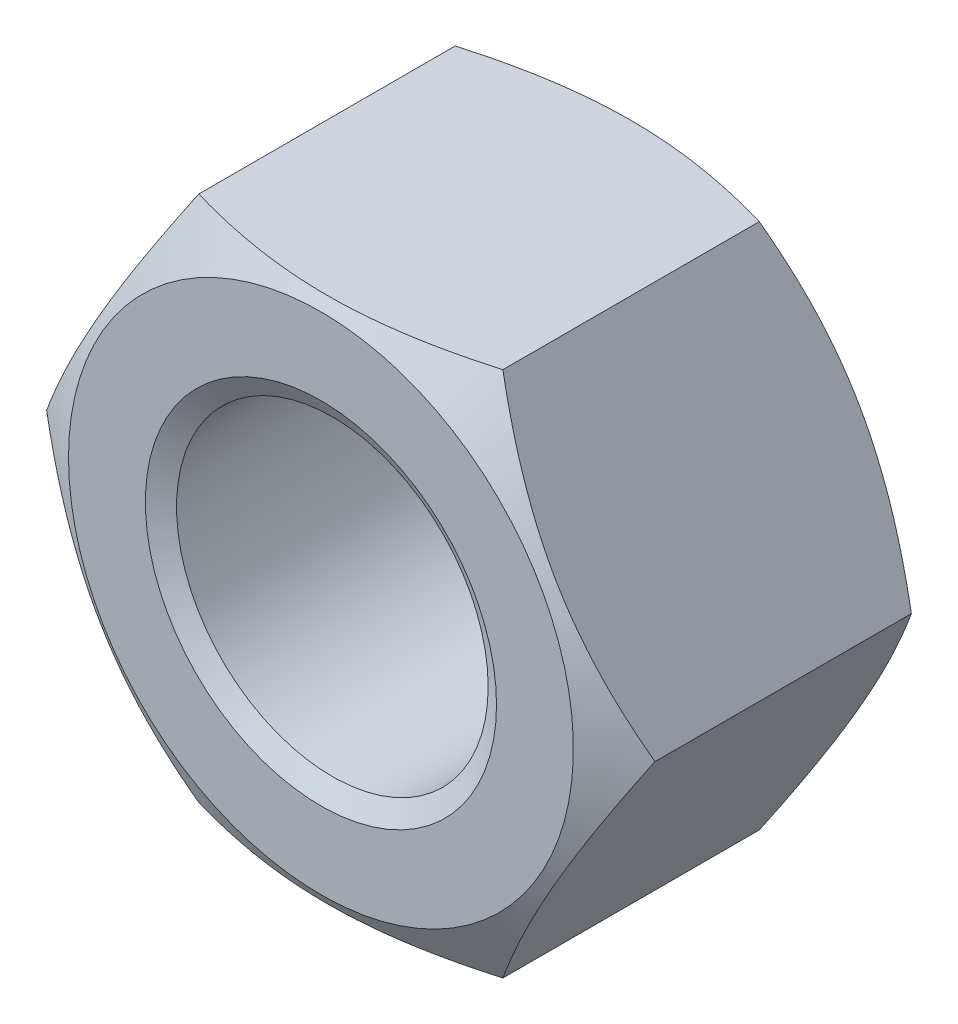
from build123d import *
from OCP.BRepFilletAPI import BRepFilletAPI_MakeChamfer

# Parameters (mm, degrees)
SKETCH1_R        = 5.3235
BASENUT_DEPTH    = 10.8
ENDCHAMFER_SIZE  = 0.675
ENDCHAMFER_SIZE2 = 0.389711432


with BuildPart() as part:
    # Sketch1 → BaseNut (new body)
    with BuildSketch(Plane.XY):
        Polygon((5.196152423, -9), (10.392304845, 0), (5.196152423, 9), (-5.196152423, 9), (-10.392304845, 0), (-5.196152423, -9), align=None)
        Circle(SKETCH1_R, mode=Mode.SUBTRACT)
    extrude(amount=-BASENUT_DEPTH)

    # Sketch2 → Double-Chamfer (revolve, cut)
    with BuildSketch(Plane(origin=(0, 0, 0), x_dir=(1, 0, 0), z_dir=(0, 1, 0))):
        Polygon((-10.392304845, 10.8), (-8.625, 10.8), (-10.392304845, 9.779646072), align=None)
        Polygon((-10.392304845, 1.020353928), (-10.392304845, 0), (-8.625, 0), align=None)
    revolve(axis=Axis((0, 0, -9.817107763), (0, 0, 1)), mode=Mode.SUBTRACT)

    # EndChamfer: one chamfer whose edges measure the first distance from different faces: ONE call of the kernel's chamfer builder (chamfer() names one face for all edges)
    endchamfer_edges_1 = [part.edges().sort_by_distance(p)[0] for p in [
        (-5.3235, 0, -10.8),
    ]]
    endchamfer_side_1 = [part.faces().sort_by_distance(p)[0] for p in [
        (-5.3235, 0, -5.4),
    ]]
    endchamfer_edges_2 = [part.edges().sort_by_distance(p)[0] for p in [
        (-5.3235, 0, 0),
    ]]
    endchamfer_side_2 = [part.faces().sort_by_distance(p)[0] for p in [
        (8.38104816, 0, 0),
    ]]
    endchamfer = BRepFilletAPI_MakeChamfer(part.part.solid().wrapped)
    for e in endchamfer_edges_1:
        endchamfer.Add(ENDCHAMFER_SIZE, ENDCHAMFER_SIZE2, e.wrapped, endchamfer_side_1[0].wrapped)  # the first distance lies on this face
    for e in endchamfer_edges_2:
        endchamfer.Add(ENDCHAMFER_SIZE, ENDCHAMFER_SIZE2, e.wrapped, endchamfer_side_2[0].wrapped)  # the first distance lies on this face
    add(Compound.cast(endchamfer.Shape()), mode=Mode.REPLACE)


solid = part.part
